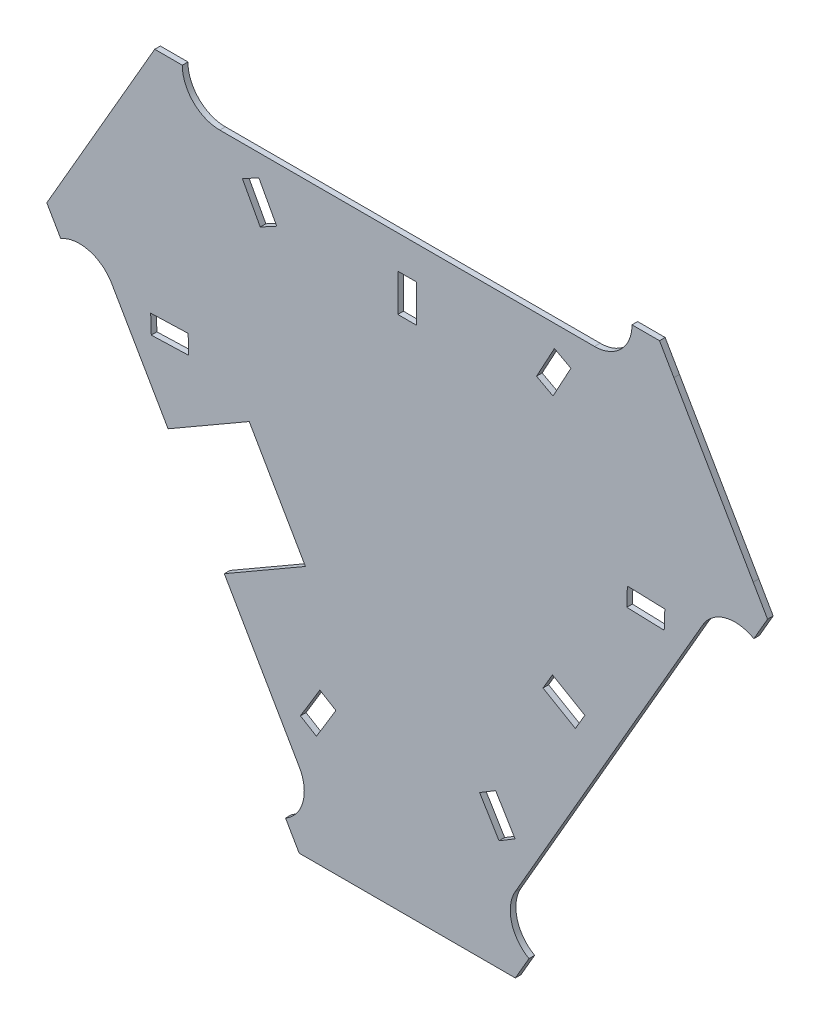
from build123d import *

# Parameters (mm, degrees)
MODEL_W                 = 10.000078668
MODEL_H                 = 19.99998508
BOSS_EXTRU_1_DEPTH      = 3
ENL_V_MAT_EXTRU_1_DEPTH = 10


with BuildPart() as part:
    # Model → Boss.-Extru.1 (new body)
    with BuildSketch(Plane.XY):
        with BuildLine():
            Line((347.504229039, -990.984743501), (447.504154456, -1164.189847387))
            add(Edge.make_bspline(
                [(447.504154456, -1164.189847387), (453.026125757, -1173.754121475), (449.749150931, -1185.983779814), (440.184876843, -1191.505837242)],
                knots=[1, 1, 1, 1, 2, 2, 2, 2], degree=3))
            Line((440.184876843, -1191.505837242), (447.468153212, -1204.120743383))
            Line((447.468153212, -1204.120743383), (462.904937066, -1204.120743383))
            Line((462.904937066, -1204.120743383), (547.394870334, -1204.120743383))
            Line((547.394870334, -1204.120743383), (562.831654188, -1204.120743383))
            Line((562.831654188, -1204.120743383), (570.114930554, -1191.505837241))
            add(Edge.make_bspline(
                [(570.114930554, -1191.505837241), (560.550656465, -1185.983779815), (557.273681638, -1173.754121476), (562.795652937, -1164.189847387)],
                knots=[7, 7, 7, 7, 8, 8, 8, 8], degree=3))
            Line((562.795652937, -1164.189847387), (662.795578323, -990.984743483))
            add(Edge.make_bspline(
                [(662.795578323, -990.984743483), (668.317549622, -981.420469394), (680.547294088, -978.143580694), (690.111568177, -983.665465865)],
                knots=[9, 9, 9, 9, 10, 10, 10, 10], degree=3))
            Line((690.111568177, -983.665465865), (697.445659701, -970.962451406))
            Line((697.445659701, -970.962451406), (689.778082931, -957.6818667))
            Line((689.778082931, -957.6818667), (647.435103324, -884.341812722))
            Line((647.435103324, -884.341812722), (639.77820635, -871.079314757))
            Line((639.77820635, -871.079314757), (625.092281057, -871.079314757))
            add(Edge.make_bspline(
                [(625.092281057, -871.079314757), (625.092281058, -882.124979905), (616.137961126, -891.079299838), (605.092295979, -891.079299839)],
                knots=[17, 17, 17, 17, 18, 18, 18, 18], degree=3))
            Line((605.092295979, -891.079299839), (405.092272921, -891.079299839))
            add(Edge.make_bspline(
                [(405.092272921, -891.079299839), (394.046607773, -891.07929984), (385.09228784, -882.124979908), (385.092287839, -871.079314761)],
                knots=[19, 19, 19, 19, 20, 20, 20, 20], degree=3))
            Line((385.092287839, -871.079314761), (370.370533553, -871.079314761))
            Line((370.370533553, -871.079314761), (312.778700066, -970.831623929))
            Line((312.778700066, -970.831623929), (320.188239184, -983.665465888))
            add(Edge.make_bspline(
                [(320.188239184, -983.665465888), (329.752513272, -978.143494587), (341.982257738, -981.420469413), (347.504229039, -990.984743501)],
                knots=[23, 23, 23, 23, 24, 24, 24, 24], degree=3))
        make_face()
        Polygon((622.618702509, -993.05007822), (642.608524558, -993.687248628), (642.290025481, -1003.682159653), (622.300031178, -1003.044989244), align=None, mode=Mode.SUBTRACT)
        Polygon((594.878104643, -1072.794736968), (577.611630575, -1062.701812979), (582.658178697, -1054.068575945), (599.924652765, -1064.161499934), align=None, mode=Mode.SUBTRACT)
        Polygon((583.685161648, -902.731560157), (592.474806017, -907.50051971), (582.937059165, -925.079722321), (574.147414796, -920.310848895), align=None, mode=Mode.SUBTRACT)
        Polygon((552.326007751, -1122.752411126), (562.689371739, -1139.857999232), (554.136577686, -1145.039681226), (543.773213697, -1127.93409312), align=None, mode=Mode.SUBTRACT)
        with Locations((505.092198326, -918.785791257)):
            Rectangle(MODEL_W, MODEL_H, mode=Mode.SUBTRACT)
        Polygon((458.493147779, -1123.193383356), (467.045941833, -1128.375065349), (456.682577848, -1145.480653457), (448.129783794, -1140.298971465), align=None, mode=Mode.SUBTRACT)
        Polygon((425.950948052, -902.731560171), (435.488694907, -920.310848907), (426.699050539, -925.079722335), (417.161303684, -907.500519726), align=None, mode=Mode.SUBTRACT)
        Polygon((428.161149075, -1054.509548181), (433.207697199, -1063.142785214), (415.941223133, -1073.235709206), (410.894675009, -1064.602472173), align=None, mode=Mode.SUBTRACT)
        Polygon((388.200625252, -993.491050463), (388.519124331, -1003.485961487), (368.529302282, -1004.123131899), (368.210803204, -994.128220875), align=None, mode=Mode.SUBTRACT)
    extrude(amount=BOSS_EXTRU_1_DEPTH)

    # Esquisse2 → Enlèv. mat.-Extru.1 (cut)
    with BuildSketch(Plane.XY.offset(3)):
        Polygon((377.504209253, -1042.946279151), (407.504189467, -1094.907814801), (450.805469176, -1069.90783129), (420.805488962, -1017.946295639), align=None)
    extrude(amount=-ENL_V_MAT_EXTRU_1_DEPTH, mode=Mode.SUBTRACT)


solid = part.part
